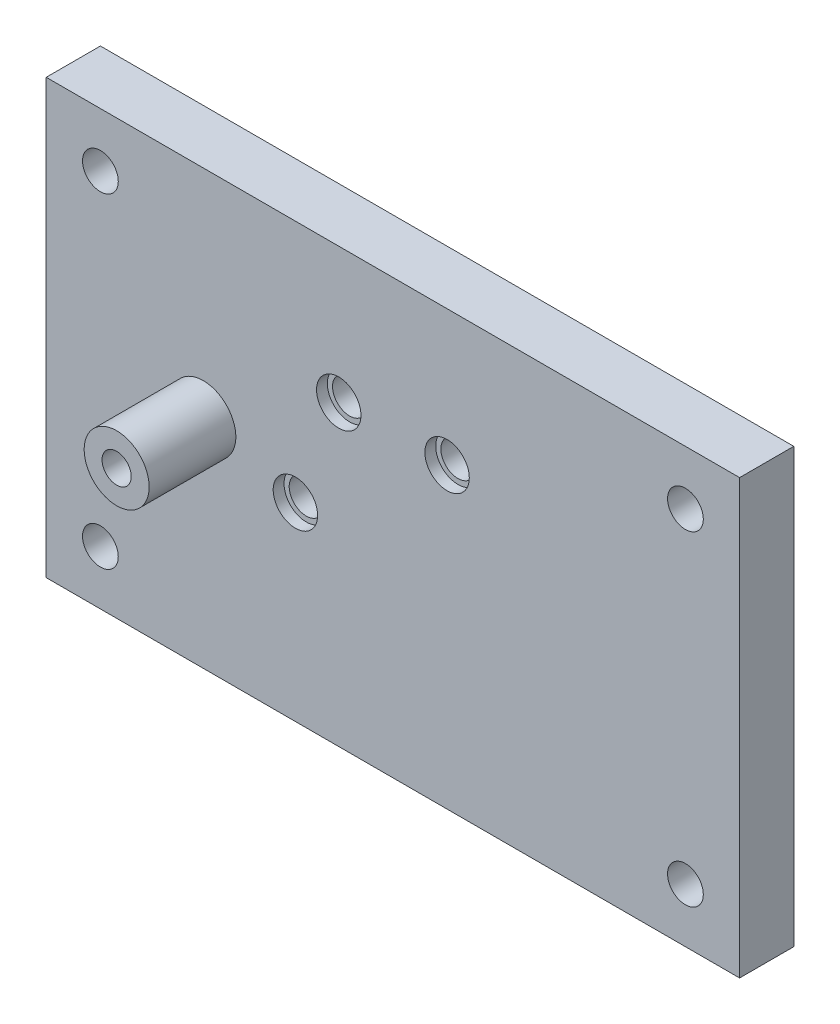
from build123d import *

# Parameters (mm, degrees)
SKETCH2_W                          = 128
SKETCH2_H                          = 80
BASE_PLATE_DEPTH                   = 10
PIVOT_PEDESTAL_START               = 10
SKETCH3_R                          = 6
PIVOT_PEDESTAL_DEPTH               = 16
SKETCH4_R                          = 2.7
PIVOT_CLEARANCE_DEPTH              = 26
SKETCH5_R                          = 3.15
LOCATOR_CLEARANCE_DEPTH            = 10
SKETCH6_R                          = 3.15
CUT_EXTRUDE3_DEPTH                 = 10
SKETCH7_R                          = 3.15
SIDE_LOCATOR_CLEARANCE_DEPTH       = 10
LOCATOR_SHOULDER_COUNTERBORE_START = 8
SKETCH8_R                          = 4.1
LOCATOR_SHOULDER_COUNTERBORE_DEPTH = 2
CUT_EXTRUDE6_START                 = 8
SKETCH9_R                          = 4.1
CUT_EXTRUDE6_DEPTH                 = 2
SIDE_SHOULDER_COUNTERBORE_START    = 8
SKETCH10_R                         = 4.1
SIDE_SHOULDER_COUNTERBORE_DEPTH    = 2
SKETCH11_R                         = 3.3
BENCH_MOUNT_M6_CLEARANCE_DEPTH     = 10
SKETCH12_R                         = 3.3
CUT_EXTRUDE9_DEPTH                 = 10
SKETCH13_R                         = 3.3
CUT_EXTRUDE10_DEPTH                = 10
SKETCH14_R                         = 3.3
CUT_EXTRUDE11_DEPTH                = 10


with BuildPart() as part:
    # Sketch2 → Base_plate (new body)
    with BuildSketch(Plane.XY):
        Rectangle(SKETCH2_W, SKETCH2_H)
    extrude(amount=BASE_PLATE_DEPTH)

    # Sketch3 → Pivot_pedestal (add)
    with BuildSketch(Plane.XY.offset(PIVOT_PEDESTAL_START)):
        with Locations(Location((-35, 0, 0), (0, 0, 180))):
            Circle(SKETCH3_R)
    extrude(amount=PIVOT_PEDESTAL_DEPTH)

    # Sketch4 → Pivot_clearance (cut)
    with BuildSketch(Plane.XY):
        with Locations(Location((-35, 0, 0), (0, 0, 180))):
            Circle(SKETCH4_R)
    extrude(amount=PIVOT_CLEARANCE_DEPTH, mode=Mode.SUBTRACT)

    # Sketch5 → Locator_clearance (cut)
    with BuildSketch(Plane.XY):
        with Locations((-10, 15)):
            Circle(SKETCH5_R)
    extrude(amount=LOCATOR_CLEARANCE_DEPTH, mode=Mode.SUBTRACT)

    # Sketch6 → Cut-Extrude3 (cut)
    with BuildSketch(Plane.XY):
        with Locations((10, 15)):
            Circle(SKETCH6_R)
    extrude(amount=CUT_EXTRUDE3_DEPTH, mode=Mode.SUBTRACT)

    # Sketch7 → Side_locator_clearance (cut)
    with BuildSketch(Plane.XY):
        with Locations((-18, -5)):
            Circle(SKETCH7_R)
    extrude(amount=SIDE_LOCATOR_CLEARANCE_DEPTH, mode=Mode.SUBTRACT)

    # Sketch8 → Locator_shoulder_counterbore (cut)
    with BuildSketch(Plane.XY.offset(LOCATOR_SHOULDER_COUNTERBORE_START)):
        with Locations((-10, 15)):
            Circle(SKETCH8_R)
    extrude(amount=LOCATOR_SHOULDER_COUNTERBORE_DEPTH, mode=Mode.SUBTRACT)

    # Sketch9 → Cut-Extrude6 (cut)
    with BuildSketch(Plane.XY.offset(CUT_EXTRUDE6_START)):
        with Locations((10, 15)):
            Circle(SKETCH9_R)
    extrude(amount=CUT_EXTRUDE6_DEPTH, mode=Mode.SUBTRACT)

    # Sketch10 → Side_shoulder_counterbore (cut)
    with BuildSketch(Plane.XY.offset(SIDE_SHOULDER_COUNTERBORE_START)):
        with Locations((-18, -5)):
            Circle(SKETCH10_R)
    extrude(amount=SIDE_SHOULDER_COUNTERBORE_DEPTH, mode=Mode.SUBTRACT)

    # Sketch11 → Bench_mount_M6_clearance (cut)
    with BuildSketch(Plane.XY):
        with Locations((-54, -30)):
            Circle(SKETCH11_R)
    extrude(amount=BENCH_MOUNT_M6_CLEARANCE_DEPTH, mode=Mode.SUBTRACT)

    # Sketch12 → Cut-Extrude9 (cut)
    with BuildSketch(Plane.XY):
        with Locations((-54, 30)):
            Circle(SKETCH12_R)
    extrude(amount=CUT_EXTRUDE9_DEPTH, mode=Mode.SUBTRACT)

    # Sketch13 → Cut-Extrude10 (cut)
    with BuildSketch(Plane.XY):
        with Locations((54, -30)):
            Circle(SKETCH13_R)
    extrude(amount=CUT_EXTRUDE10_DEPTH, mode=Mode.SUBTRACT)

    # Sketch14 → Cut-Extrude11 (cut)
    with BuildSketch(Plane.XY):
        with Locations((54, 30)):
            Circle(SKETCH14_R)
    extrude(amount=CUT_EXTRUDE11_DEPTH, mode=Mode.SUBTRACT)


solid = part.part
